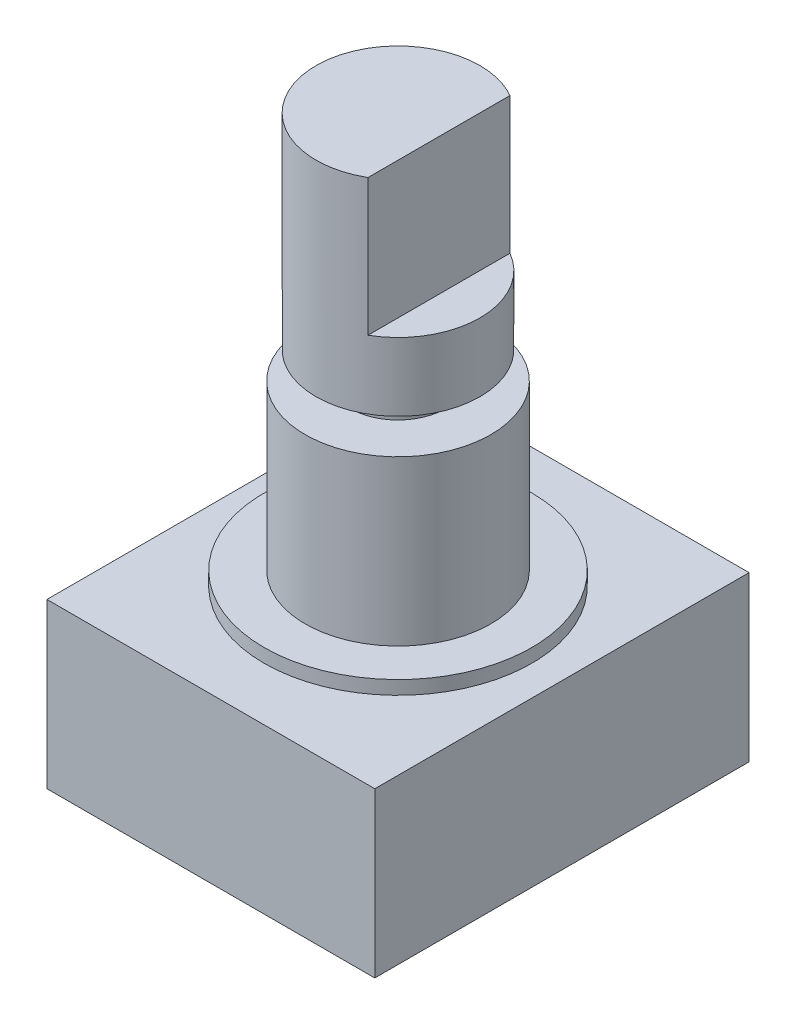
from build123d import *

# Parameters (mm, degrees)
SKETCH2_W           = 3
SKETCH2_H           = 5.196152422
CUT_EXTRUDE1_DEPTH  = 5
SKETCH3_W           = 12
SKETCH3_H           = 13.7
BOSS_EXTRUDE1_DEPTH = 6


with BuildPart() as part:
    # Sketch1 → Revolve1 (revolve)
    with BuildSketch(Plane.XY, mode=Mode.PRIVATE) as revolve1_sk:
        Polygon((0, 15), (-3, 15), (-3, 7.5), (-1.75, 7.5), (-1.75, 6.5), (-3.4, 6.5), (-3.4, 0.5), (-4.9, 0.5), (-4.9, 0), (0, 0), align=None)
    revolve(revolve1_sk.sketch.rotate(Axis((0, 0, 0), (0, 1, 0)), 270), axis=Axis((0, 0, 0), (0, 1, 0)))

    # Sketch2 → Cut-Extrude1 (cut)
    with BuildSketch(Plane(origin=(0, 15, 0), x_dir=(1, 0, 0), z_dir=(0, 1, 0))):
        with Locations((3, 0)):
            Rectangle(SKETCH2_W, SKETCH2_H)
    extrude(amount=-CUT_EXTRUDE1_DEPTH, mode=Mode.SUBTRACT)

    # Sketch3 → Boss-Extrude1 (add)
    with BuildSketch(Plane(origin=(0, 0, 0), x_dir=(-1, 0, 0), z_dir=(0, -1, 0))):
        Rectangle(SKETCH3_W, SKETCH3_H)
    extrude(amount=BOSS_EXTRUDE1_DEPTH)


solid = part.part
